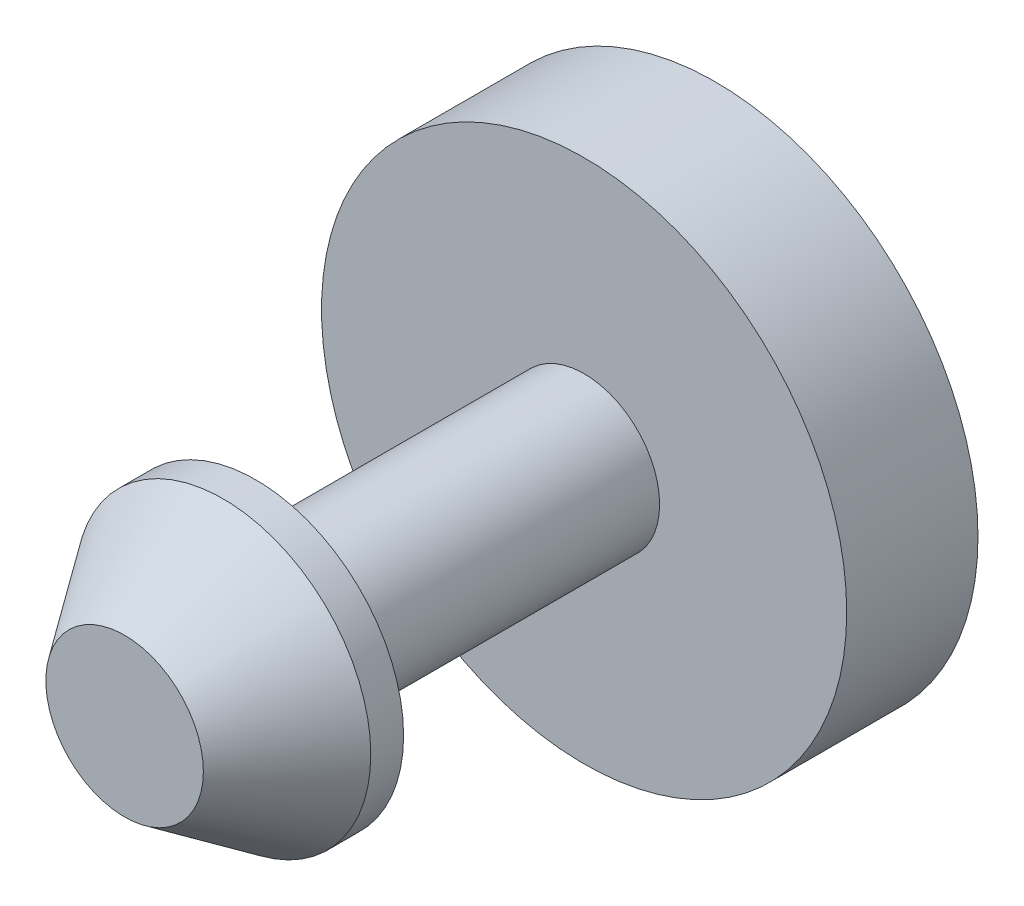
from build123d import *

# Parameters (mm, degrees)
SKETCH_1_R      = 4
EXTRUDE_1_DEPTH = 2
SKETCH_2_R      = 1.15
EXTRUDE_2_DEPTH = 5
SKETCH_3_R      = 2.25
EXTRUDE_3_DEPTH = 0.5
SKETCH_4_R      = 2.25
EXTRUDE_4_DEPTH = 1.5
EXTRUDE_4_TAPER = 35


with BuildPart() as part:
    # 스케치1 → 보스-돌출1 (new body)
    with BuildSketch(Plane.XY):
        Circle(SKETCH_1_R)
    extrude(amount=EXTRUDE_1_DEPTH)

    # 스케치2 → 보스-돌출2 (add)
    with BuildSketch(Plane.XY.offset(2)):
        Circle(SKETCH_2_R)
    extrude(amount=EXTRUDE_2_DEPTH)

    # 스케치3 → 보스-돌출3 (add)
    with BuildSketch(Plane.XY.offset(7)):
        Circle(SKETCH_3_R)
    extrude(amount=EXTRUDE_3_DEPTH)

    # 스케치4 → 보스-돌출4 (add)
    with BuildSketch(Plane.XY.offset(7.5)):
        Circle(SKETCH_4_R)
    extrude(amount=EXTRUDE_4_DEPTH, taper=EXTRUDE_4_TAPER)


solid = part.part
